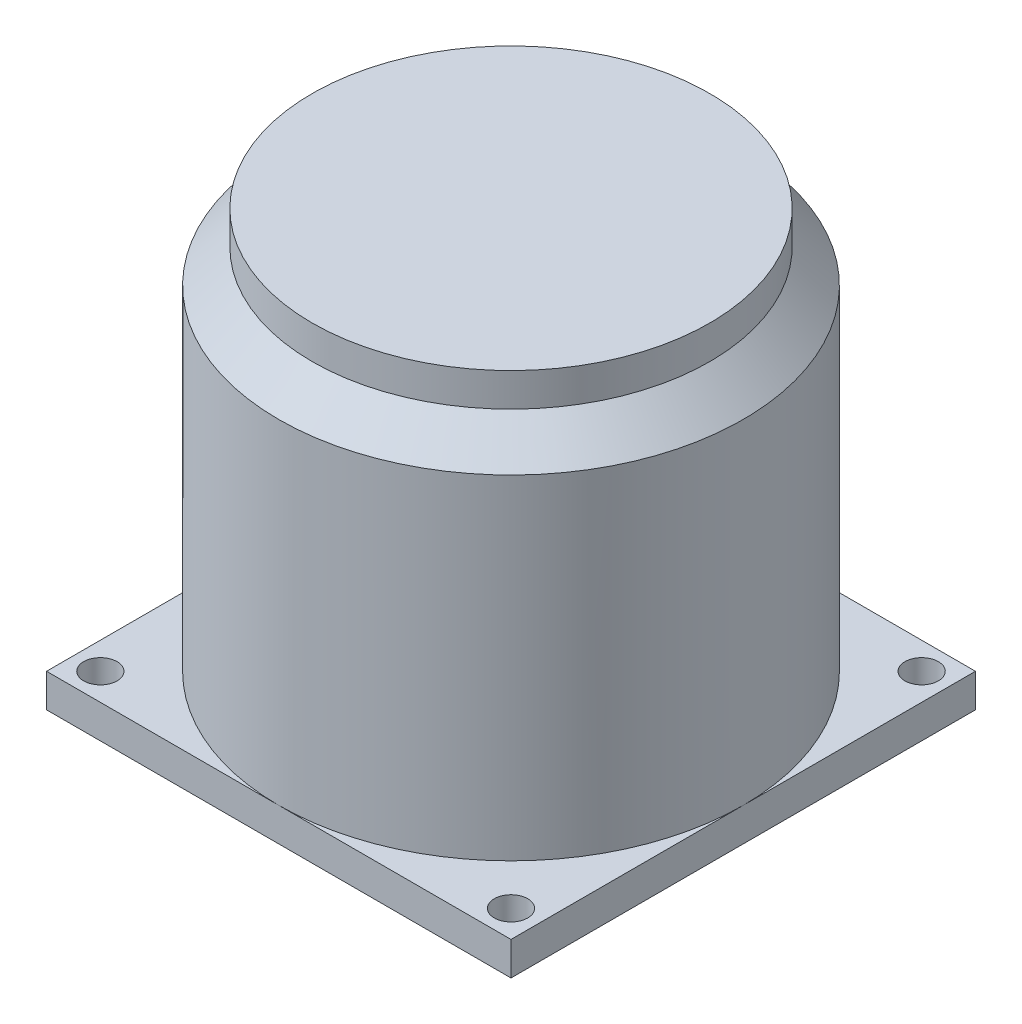
from build123d import *

# Parameters (mm, degrees)
SKETCH1_R           = 139
BOSS_EXTRUDE5_DEPTH = 220
CHAMFER6_SIZE       = 20
SKETCH9_R           = 119
BOSS_EXTRUDE6_DEPTH = 20
BOSS_EXTRUDE7_START = 20
SKETCH10_R          = 10
BOSS_EXTRUDE7_DEPTH = 20


with BuildPart() as part:
    # Sketch1 → Boss-Extrude5 (new body)
    with BuildSketch(Plane(origin=(0, 0, 0), x_dir=(1, 0, 0), z_dir=(0, 1, 0))):
        with Locations(Location((0, 0, 0), (0, 0, 270))):
            Circle(SKETCH1_R)
    extrude(amount=BOSS_EXTRUDE5_DEPTH)

    # Chamfer6
    chamfer6_edges = [part.edges().sort_by_distance(p)[0] for p in [
        (0, 220, -139),
    ]]
    chamfer(chamfer6_edges, length=CHAMFER6_SIZE)

    # Sketch9 → Boss-Extrude6 (add)
    with BuildSketch(Plane(origin=(0, 220, 0), x_dir=(1, 0, 0), z_dir=(0, 1, 0))):
        with Locations(Location((0, 0, 0), (0, 0, 270))):
            Circle(SKETCH9_R)
    extrude(amount=BOSS_EXTRUDE6_DEPTH)

    # Sketch10 → Boss-Extrude7 (add)
    # profile 1 of 20: a face of its own
    with BuildSketch(Plane.XZ.offset(BOSS_EXTRUDE7_START)):
        with BuildLine():
            ThreePointArc((-139, 0), (-98.287842585, 98.287842585), (0, 139))
            Line((0, 139), (-139, 139))
            Line((-139, 139), (-139, 0))
        make_face()
        with Locations(Location((-122.899316497, 122.899316497, 0), (0, 0, 270))):
            Circle(SKETCH10_R, mode=Mode.SUBTRACT)
    # profile 2 of 20: a face of its own
    with BuildSketch(Plane.XZ.offset(BOSS_EXTRUDE7_START)):
        with BuildLine():
            Line((139, 139), (0, 139))
            ThreePointArc((0, 139), (98.287842585, 98.287842585), (139, 0))
            Line((139, 0), (139, 139))
        make_face()
        with Locations(Location((122.899316497, 122.899316497, 0), (0, 0, 270))):
            Circle(SKETCH10_R, mode=Mode.SUBTRACT)
    # profile 3 of 20: a face of its own
    with BuildSketch(Plane.XZ.offset(BOSS_EXTRUDE7_START)):
        with BuildLine():
            Line((139, -139), (139, 0))
            ThreePointArc((139, 0), (98.287842585, -98.287842585), (0, -139))
            Line((0, -139), (139, -139))
        make_face()
        with Locations(Location((122.899316497, -122.899316497, 0), (0, 0, 270))):
            Circle(SKETCH10_R, mode=Mode.SUBTRACT)
    # profile 4 of 20: a face of its own
    with BuildSketch(Plane.XZ.offset(BOSS_EXTRUDE7_START)):
        with BuildLine():
            ThreePointArc((0, -139), (-98.287842585, -98.287842585), (-139, 0))
            Line((-139, 0), (-139, -139))
            Line((-139, -139), (0, -139))
        make_face()
        with Locations(Location((-122.899316497, -122.899316497, 0), (0, 0, 270))):
            Circle(SKETCH10_R, mode=Mode.SUBTRACT)
    # profile 5 of 20: a face of its own
    with BuildSketch(Plane.XZ.offset(BOSS_EXTRUDE7_START)):
        with BuildLine():
            ThreePointArc((139, 0), (98.287842585, 98.287842585), (0, 139))
            Line((0, 139), (0, 0))
            Line((0, 0), (139, 0))
        make_face()
    # profile 6 of 20: a face of its own
    with BuildSketch(Plane.XZ.offset(BOSS_EXTRUDE7_START)):
        with BuildLine():
            Line((0, 0), (0, 139))
            ThreePointArc((0, 139), (-98.287842585, 98.287842585), (-139, 0))
            Line((-139, 0), (0, 0))
        make_face()
    # profile 7 of 20: a face of its own
    with BuildSketch(Plane.XZ.offset(BOSS_EXTRUDE7_START)):
        with BuildLine():
            Line((139, 0), (0, 0))
            Line((0, 0), (0, -139))
            ThreePointArc((0, -139), (98.287842585, -98.287842585), (139, 0))
        make_face()
    # profile 8 of 20: a face of its own
    with BuildSketch(Plane.XZ.offset(BOSS_EXTRUDE7_START)):
        with BuildLine():
            Line((0, -139), (0, 0))
            Line((0, 0), (-139, 0))
            ThreePointArc((-139, 0), (-98.287842585, -98.287842585), (0, -139))
        make_face()
    # profile 9 of 20: a face of its own
    with BuildSketch(Plane.XZ.offset(BOSS_EXTRUDE7_START)):
        with BuildLine():
            ThreePointArc((139, 0), (98.287842585, 98.287842585), (0, 139))
            Line((0, 139), (0, 0))
            Line((0, 0), (139, 0))
        make_face()
    # profile 10 of 20: a face of its own
    with BuildSketch(Plane.XZ.offset(BOSS_EXTRUDE7_START)):
        with BuildLine():
            Line((0, 0), (0, 139))
            ThreePointArc((0, 139), (-98.287842585, 98.287842585), (-139, 0))
            Line((-139, 0), (0, 0))
        make_face()
    # profile 11 of 20: a face of its own
    with BuildSketch(Plane.XZ.offset(BOSS_EXTRUDE7_START)):
        with BuildLine():
            Line((139, 0), (0, 0))
            Line((0, 0), (0, -139))
            ThreePointArc((0, -139), (98.287842585, -98.287842585), (139, 0))
        make_face()
    # profile 12 of 20: a face of its own
    with BuildSketch(Plane.XZ.offset(BOSS_EXTRUDE7_START)):
        with BuildLine():
            Line((0, -139), (0, 0))
            Line((0, 0), (-139, 0))
            ThreePointArc((-139, 0), (-98.287842585, -98.287842585), (0, -139))
        make_face()
    # profile 13 of 20: a face of its own
    with BuildSketch(Plane.XZ.offset(BOSS_EXTRUDE7_START)):
        with BuildLine():
            ThreePointArc((139, 0), (98.287842585, 98.287842585), (0, 139))
            Line((0, 139), (0, 0))
            Line((0, 0), (139, 0))
        make_face()
    # profile 14 of 20: a face of its own
    with BuildSketch(Plane.XZ.offset(BOSS_EXTRUDE7_START)):
        with BuildLine():
            Line((0, 0), (0, 139))
            ThreePointArc((0, 139), (-98.287842585, 98.287842585), (-139, 0))
            Line((-139, 0), (0, 0))
        make_face()
    # profile 15 of 20: a face of its own
    with BuildSketch(Plane.XZ.offset(BOSS_EXTRUDE7_START)):
        with BuildLine():
            Line((139, 0), (0, 0))
            Line((0, 0), (0, -139))
            ThreePointArc((0, -139), (98.287842585, -98.287842585), (139, 0))
        make_face()
    # profile 16 of 20: a face of its own
    with BuildSketch(Plane.XZ.offset(BOSS_EXTRUDE7_START)):
        with BuildLine():
            Line((0, -139), (0, 0))
            Line((0, 0), (-139, 0))
            ThreePointArc((-139, 0), (-98.287842585, -98.287842585), (0, -139))
        make_face()
    # profile 17 of 20: a face of its own
    with BuildSketch(Plane.XZ.offset(BOSS_EXTRUDE7_START)):
        with BuildLine():
            ThreePointArc((139, 0), (98.287842585, 98.287842585), (0, 139))
            Line((0, 139), (0, 0))
            Line((0, 0), (139, 0))
        make_face()
    # profile 18 of 20: a face of its own
    with BuildSketch(Plane.XZ.offset(BOSS_EXTRUDE7_START)):
        with BuildLine():
            Line((0, 0), (0, 139))
            ThreePointArc((0, 139), (-98.287842585, 98.287842585), (-139, 0))
            Line((-139, 0), (0, 0))
        make_face()
    # profile 19 of 20: a face of its own
    with BuildSketch(Plane.XZ.offset(BOSS_EXTRUDE7_START)):
        with BuildLine():
            Line((139, 0), (0, 0))
            Line((0, 0), (0, -139))
            ThreePointArc((0, -139), (98.287842585, -98.287842585), (139, 0))
        make_face()
    # profile 20 of 20: a face of its own
    with BuildSketch(Plane.XZ.offset(BOSS_EXTRUDE7_START)):
        with BuildLine():
            Line((0, -139), (0, 0))
            Line((0, 0), (-139, 0))
            ThreePointArc((-139, 0), (-98.287842585, -98.287842585), (0, -139))
        make_face()
    extrude(amount=-BOSS_EXTRUDE7_DEPTH)


solid = part.part
